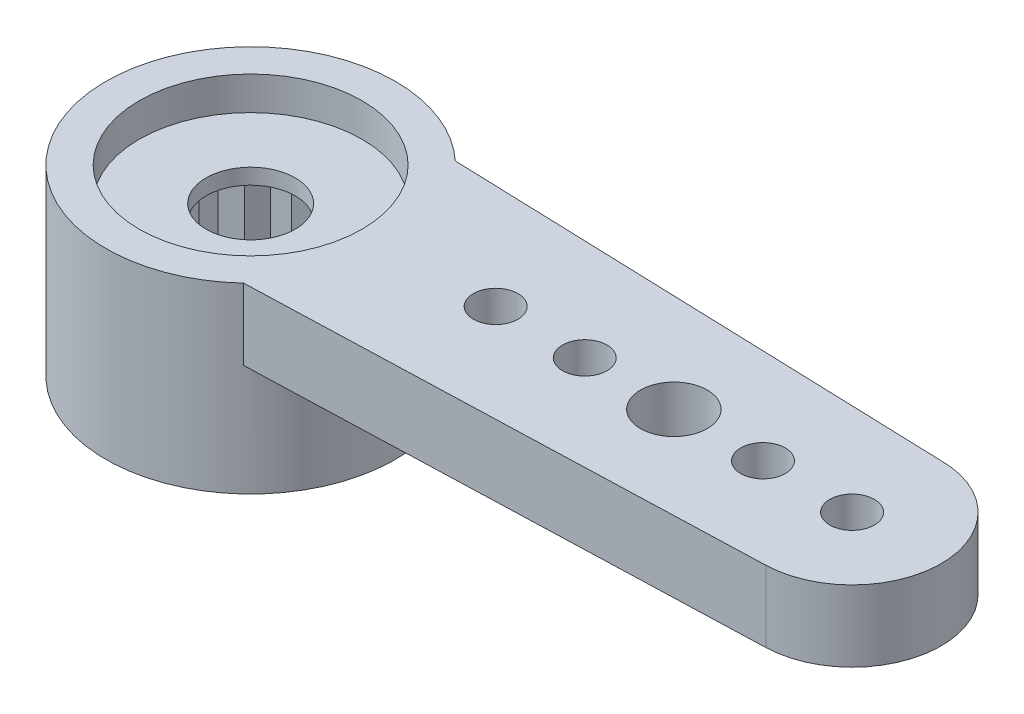
from build123d import *

# Parameters (mm, degrees)
SKETCH1_R           = 0.5
SKETCH1_R_2         = 0.75
BOSS_EXTRUDE1_DEPTH = 1.6
BOSS_EXTRUDE2_START = 2.5
SKETCH2_R           = 3.25
BOSS_EXTRUDE2_DEPTH = 2.5
SKETCH4_R           = 1
CUT_EXTRUDE1_DEPTH  = 17.359171739
CUT_EXTRUDE2_DEPTH  = 3
SKETCH3_R           = 2.5
CUT_EXTRUDE3_DEPTH  = 0.75


with BuildPart() as part:
    # Sketch1 → Boss-Extrude1 (new body)
    with BuildSketch(Plane(origin=(0, 0, 0), x_dir=(1, 0, 0), z_dir=(0, 1, 0))):
        with BuildLine():
            Line((2.218529919, 2.375), (13.5, 2))
            ThreePointArc((13.5, 2), (15.499725592, 0.033129364), (13.566249638, -1.998902445))
            Line((13.566249638, -1.998902445), (2.218529919, -2.375))
            ThreePointArc((2.218529919, -2.375), (-3.25, 0), (2.218529919, 2.375))
        make_face()
        with Locations(Location((13.5, 0, 0), (0, 0, 270))):
            Circle(SKETCH1_R, mode=Mode.SUBTRACT)
        with Locations(Location((11.5, 0, 0), (0, 0, 270))):
            Circle(SKETCH1_R, mode=Mode.SUBTRACT)
        with Locations(Location((9.5, 0, 0), (0, 0, 270))):
            Circle(SKETCH1_R_2, mode=Mode.SUBTRACT)
        with Locations(Location((7.5, 0, 0), (0, 0, 270))):
            Circle(SKETCH1_R, mode=Mode.SUBTRACT)
        with Locations(Location((5.5, 0, 0), (0, 0, 270))):
            Circle(SKETCH1_R, mode=Mode.SUBTRACT)
    extrude(amount=BOSS_EXTRUDE1_DEPTH)

    # Sketch2 → Boss-Extrude2 (add)
    with BuildSketch(Plane.XZ.offset(BOSS_EXTRUDE2_START)):
        with Locations(Location((0, 0, 0), (0, 0, 270))):
            Circle(SKETCH2_R)
    extrude(amount=-BOSS_EXTRUDE2_DEPTH)

    # Sketch4 → Cut-Extrude1 (cut, through all)
    with BuildSketch(Plane(origin=(0, 1.6, 0), x_dir=(1, 0, 0), z_dir=(0, 1, 0))):
        with Locations(Location((0, 0, 0), (0, 0, 270))):
            Circle(SKETCH4_R)
    extrude(amount=-CUT_EXTRUDE1_DEPTH, mode=Mode.SUBTRACT)

    # Sketch5 → Cut-Extrude2 (cut)
    with BuildSketch(Plane.XZ.offset(2.5)):
        Polygon((0, 2), (0.374241043, 1.760665681), (0.813473286, 1.827090915), (1.058013454, 1.45623059), (1.486289651, 1.338261213), (1.558845727, 0.9), (1.902113033, 0.618033989), (1.790139412, 0.188151234), (1.989043791, -0.209056927), (1.711901729, -0.55623059), (1.732050808, -1), (1.337660686, -1.204435091), (1.175570505, -1.618033989), (0.732125958, -1.644381824), (0.415823382, -1.956295201), (0, -1.8), (-0.415823382, -1.956295201), (-0.732125958, -1.644381824), (-1.175570505, -1.618033989), (-1.337660686, -1.204435091), (-1.732050808, -1), (-1.711901729, -0.55623059), (-1.989043791, -0.209056927), (-1.790139412, 0.188151234), (-1.902113033, 0.618033989), (-1.558845727, 0.9), (-1.486289651, 1.338261213), (-1.058013454, 1.45623059), (-0.813473286, 1.827090915), (-0.374241043, 1.760665681), align=None)
    extrude(amount=-CUT_EXTRUDE2_DEPTH, mode=Mode.SUBTRACT)

    # Sketch3 → Cut-Extrude3 (cut)
    with BuildSketch(Plane(origin=(0, 1.6, 0), x_dir=(1, 0, 0), z_dir=(0, 1, 0))):
        with Locations(Location((0, 0, 0), (0, 0, 270))):
            Circle(SKETCH3_R)
    extrude(amount=-CUT_EXTRUDE3_DEPTH, mode=Mode.SUBTRACT)


solid = part.part
